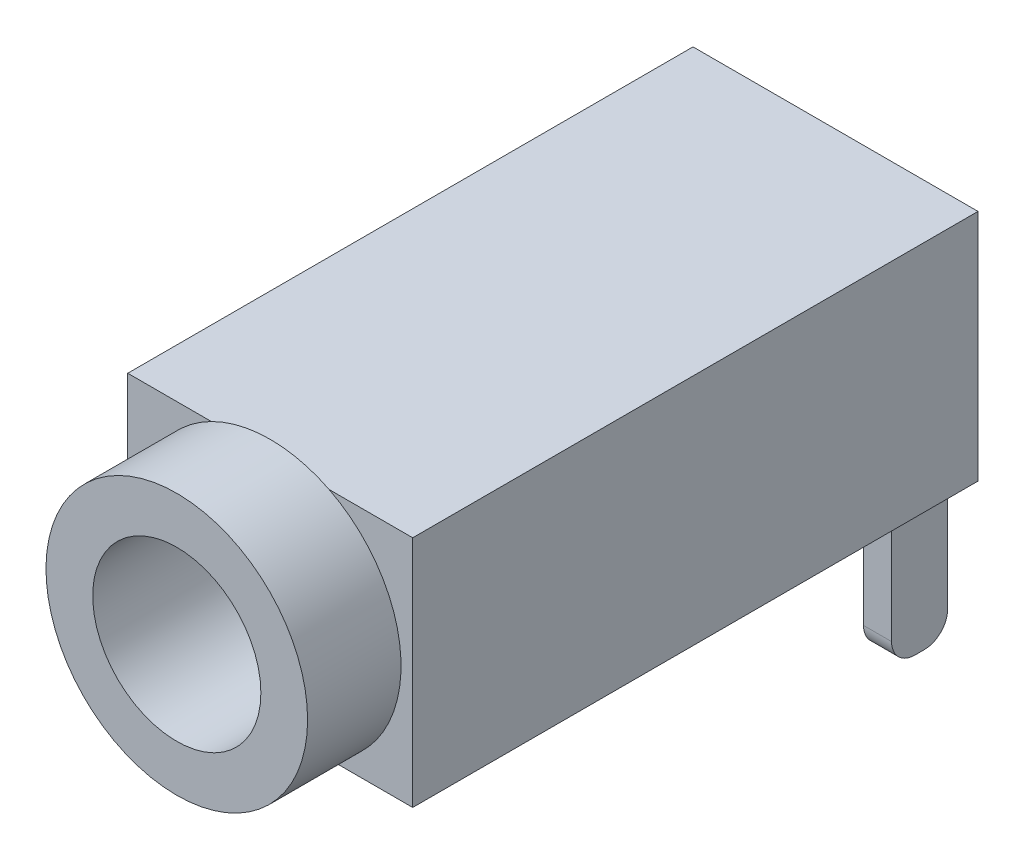
from build123d import *

# Parameters (mm, degrees)
SKETCH1_W           = 6.1
SKETCH1_H           = 5
BOSS_EXTRUDE1_DEPTH = 12.1
SKETCH2_R           = 2.8
BOSS_EXTRUDE2_DEPTH = 2
SKETCH3_R           = 1.8
CUT_EXTRUDE1_DEPTH  = 10
SKETCH4_R           = 0.75
BOSS_EXTRUDE3_DEPTH = 0.8
SKETCH5_W           = 0.6
SKETCH5_H           = 1.1
SKETCH5_H_2         = 0.1
SKETCH5_H_3         = 1.2
BOSS_EXTRUDE4_DEPTH = 3
FILLET1_R           = 0.5
FILLET2_R           = 0.1


with BuildPart() as part:
    # Sketch1 → Boss-Extrude1 (new body)
    with BuildSketch(Plane.XY):
        Rectangle(SKETCH1_W, SKETCH1_H)
    extrude(amount=BOSS_EXTRUDE1_DEPTH)

    # Sketch2 → Boss-Extrude2 (add)
    with BuildSketch(Plane.XY.offset(12.1)):
        with Locations(Location((0, 0, 0), (0, 0, 116.765500577))):
            Circle(SKETCH2_R)
    extrude(amount=BOSS_EXTRUDE2_DEPTH)

    # Sketch3 → Cut-Extrude1 (cut)
    with BuildSketch(Plane.XY.offset(14.1)):
        Circle(SKETCH3_R)
    extrude(amount=-CUT_EXTRUDE1_DEPTH, mode=Mode.SUBTRACT)

    # Sketch4 → Boss-Extrude3 (add)
    with BuildSketch(Plane.XZ.offset(2.5)):
        with Locations(Location((0, 10.5, 0), (0, 0, 90))):
            Circle(SKETCH4_R)
        with Locations(Location((0, 3.5, 0), (0, 0, 90))):
            Circle(SKETCH4_R)
    extrude(amount=BOSS_EXTRUDE3_DEPTH)

    # Sketch5 → Boss-Extrude4 (add)
    with BuildSketch(Plane.XZ.offset(2.5)):
        with Locations((-2.3, 1.95)):
            Rectangle(SKETCH5_W, SKETCH5_H)
        with Locations((-2.3, 1.35)):
            Rectangle(SKETCH5_W, SKETCH5_H_2)
        with Locations((-2.3, 5.9)):
            Rectangle(SKETCH5_W, SKETCH5_H_3)
        with Locations((2.3, 0.75)):
            Rectangle(SKETCH5_W, SKETCH5_H)
        with Locations((2.3, 1.35)):
            Rectangle(SKETCH5_W, SKETCH5_H_2)
        with Locations((-2.3, 8.9)):
            Rectangle(SKETCH5_W, SKETCH5_H_3)
    extrude(amount=BOSS_EXTRUDE4_DEPTH)

    # Fillet1
    fillet1_edges = [part.edges().sort_by_distance(p)[0] for p in [
        (-2.3, -5.5, 1.3),
        (-2.3, -5.5, 2.5),
        (-2.3, -5.5, 5.3),
        (-2.3, -5.5, 6.5),
        (2.3, -5.5, 0.2),
        (2.3, -5.5, 1.4),
        (-2.3, -5.5, 8.3),
        (-2.3, -5.5, 9.5),
    ]]
    fillet(fillet1_edges, radius=FILLET1_R)

    # Fillet2
    fillet2_edges = [part.edges().sort_by_distance(p)[0] for p in [
        (0, -3.3, 9.75),
        (0, -3.3, 2.75),
    ]]
    fillet(fillet2_edges, radius=FILLET2_R)


solid = part.part
